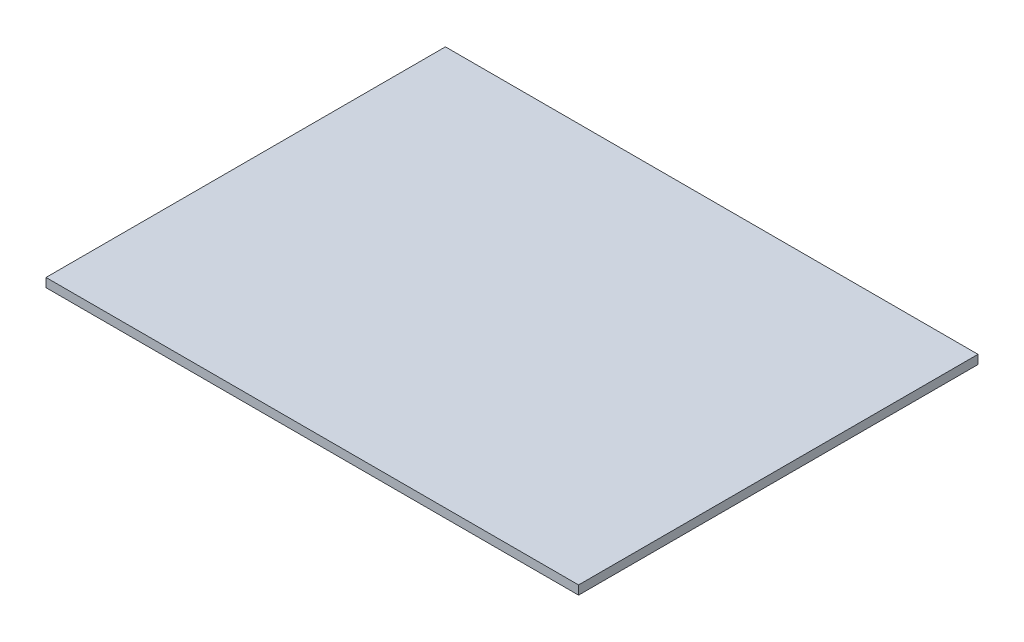
from build123d import *

# Parameters (mm, degrees)
SKETCH_1_W      = 120
SKETCH_1_H      = 90
EXTRUDE_1_DEPTH = 2


with BuildPart() as part:
    # 草图1 → 凸台-拉伸1 (new body)
    with BuildSketch(Plane(origin=(0, 0, 0), x_dir=(1, 0, 0), z_dir=(0, 1, 0))):
        Rectangle(SKETCH_1_W, SKETCH_1_H)
    extrude(amount=EXTRUDE_1_DEPTH)


solid = part.part
